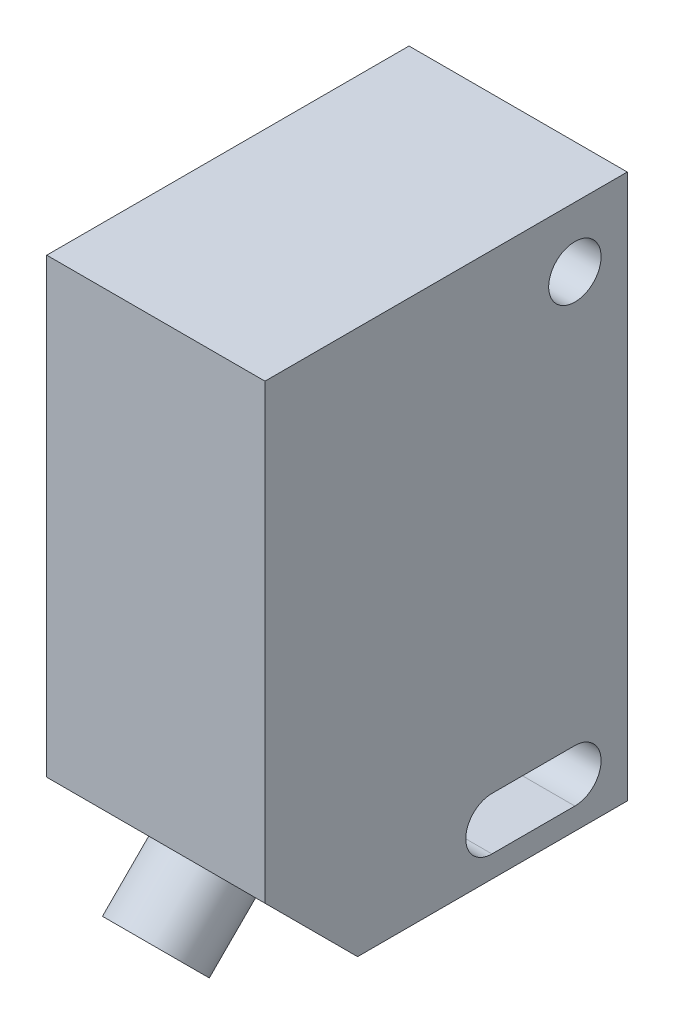
from build123d import *

# Parameters (mm, degrees)
SKETCH1_R           = 1.524
BOSS_EXTRUDE1_DEPTH = 12.7
SKETCH3_R           = 2.54
BOSS_EXTRUDE2_DEPTH = 3.81


with BuildPart() as part:
    # Sketch1 → Boss-Extrude1 (new body)
    with BuildSketch(Plane(origin=(0, 0, 0), x_dir=(0, 0, -1), z_dir=(1, 0, 0))):
        Polygon((-21.082, 5.388153673), (-15.693846327, 0), (0, 0), (0, 31.7), (-21.082, 31.7), align=None)
        with Locations((-3.048, 28.194)):
            Circle(SKETCH1_R, mode=Mode.SUBTRACT)
        with BuildLine():
            Line((-7.874, 4.318), (-3.048, 4.318))
            ThreePointArc((-3.048, 4.318), (-1.524, 2.794), (-3.048, 1.27))
            Line((-3.048, 1.27), (-7.874, 1.27))
            ThreePointArc((-7.874, 1.27), (-9.398, 2.794), (-7.874, 4.318))
        make_face(mode=Mode.SUBTRACT)
    extrude(amount=BOSS_EXTRUDE1_DEPTH)

    # Sketch3 → Boss-Extrude2 (add)
    with BuildSketch(Plane(origin=(0, -7.846923164, 7.846923164), x_dir=(1, 0, 0), z_dir=(0, -0.7071067811865464, 0.7071067811865488))):
        with Locations(Location((6.35, 14.907225161, 0), (0, 0, 270))):
            Circle(SKETCH3_R)
    extrude(amount=BOSS_EXTRUDE2_DEPTH)


solid = part.part
